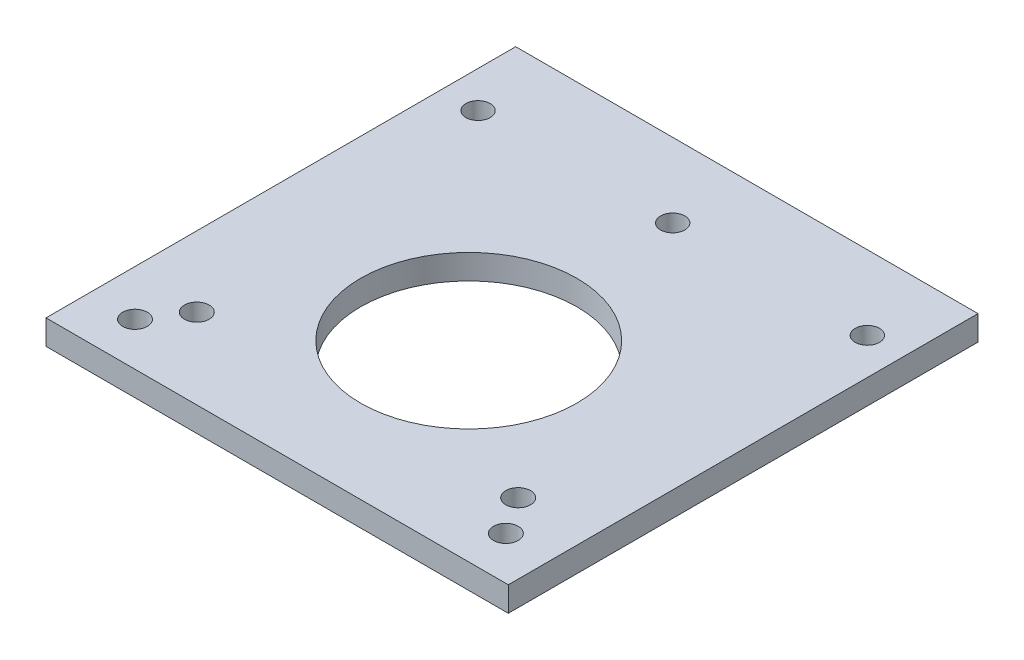
from build123d import *

# Parameters (mm, degrees)
SKETCH2_W                 = 95
SKETCH2_H                 = 96.52
BOSS_EXTRUDE3_DEPTH       = 5.08
SKETCH3_R                 = 22.225
CUT_EXTRUDE1_DEPTH        = 78.447905072
M6X1_0_TAPPED_HOLE1_D     = 5
M6X1_0_TAPPED_HOLE1_DEPTH = 5.08
M6X1_0_TAPPED_HOLE1_TIP   = 1.502151548
SKETCH7_R                 = 2.54
CUT_EXTRUDE2_DEPTH        = 7.62


with BuildPart() as part:
    # Sketch2 → Boss-Extrude3 (new body)
    with BuildSketch(Plane(origin=(0, 0, 0), x_dir=(1, 0, 0), z_dir=(0, 1, 0))):
        with Locations((0, -12.7)):
            Rectangle(SKETCH2_W, SKETCH2_H)
    extrude(amount=BOSS_EXTRUDE3_DEPTH)

    # Sketch3 → Cut-Extrude1 (cut, through all)
    with BuildSketch(Plane(origin=(0, 5.08, 0), x_dir=(1, 0, 0), z_dir=(0, 1, 0))):
        with Locations(Location((0, -21.59, 0), (0, 0, 270))):
            Circle(SKETCH3_R)
    extrude(amount=-CUT_EXTRUDE1_DEPTH, mode=Mode.SUBTRACT)

    # M6x1.0 Tapped Hole1
    with Locations(Plane(origin=(0, 5.08, 0), x_dir=(1, 0, 0), z_dir=(0, 1, 0))):
        with Locations((-40, 20.32), (40, 20.32), (0, 20.32)):
            Hole(M6X1_0_TAPPED_HOLE1_D / 2, depth=M6X1_0_TAPPED_HOLE1_DEPTH)
            with Locations((0, 0, -(M6X1_0_TAPPED_HOLE1_DEPTH + M6X1_0_TAPPED_HOLE1_TIP / 2))):  # 118° drill point
                Cone(0, M6X1_0_TAPPED_HOLE1_D / 2, M6X1_0_TAPPED_HOLE1_TIP, mode=Mode.SUBTRACT)

    # Sketch7 → Cut-Extrude2 (cut)
    with BuildSketch(Plane(origin=(0, 5.08, 0), x_dir=(1, 0, 0), z_dir=(0, 1, 0))):
        with Locations(Location((-33.02, -44.45, 0), (0, 0, 270))):
            Circle(SKETCH7_R)
        with Locations(Location((33.02, -44.45, 0), (0, 0, 270))):
            Circle(SKETCH7_R)
        with Locations(Location((-38.1, -52.07, 0), (0, 0, 270))):
            Circle(SKETCH7_R)
        with Locations(Location((38.1, -52.07, 0), (0, 0, 270))):
            Circle(SKETCH7_R)
    extrude(amount=-CUT_EXTRUDE2_DEPTH, mode=Mode.SUBTRACT)


solid = part.part
